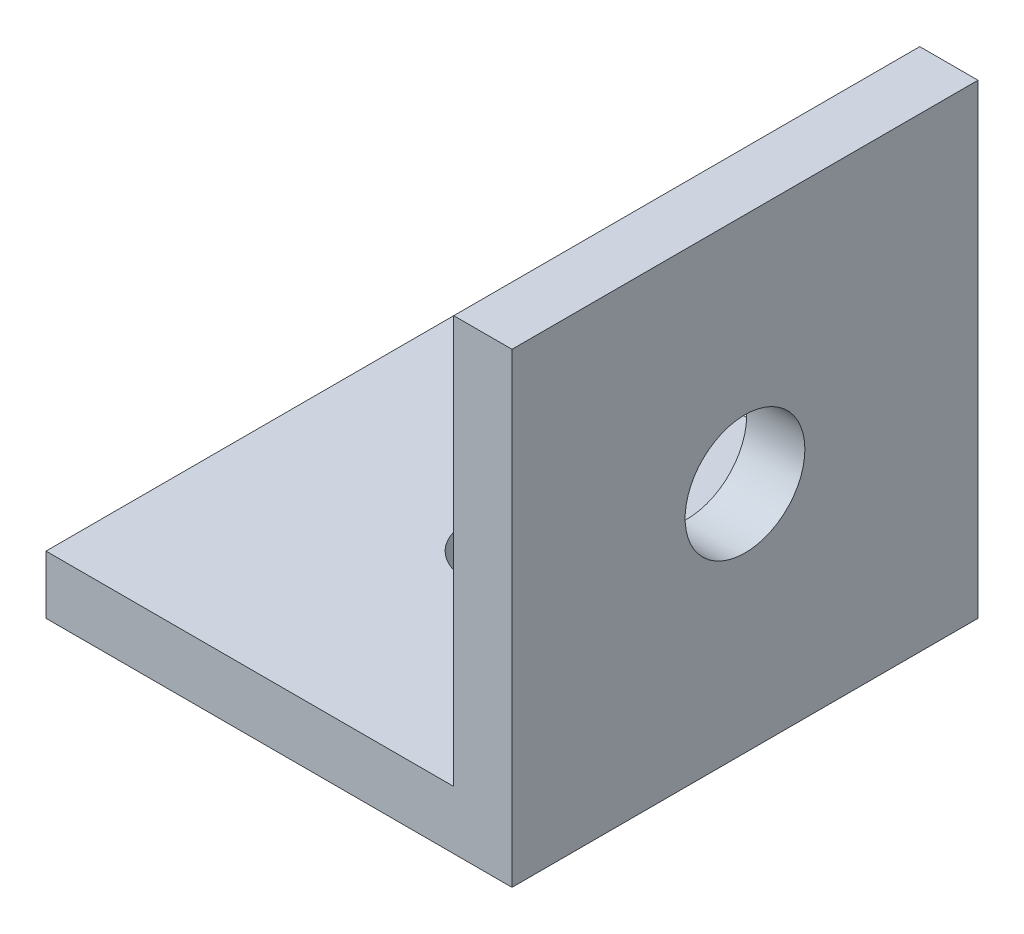
from build123d import *

# Parameters (mm, degrees)
BOSS_EXTRUDE1_DEPTH              = 25.4
F_13_64_0_20313_DIAMETER_HOLE1_D = 5.159375
F_0_257_DIAMETER_HOLE1_D         = 6.5278


with BuildPart() as part:
    # Sketch1 → Boss-Extrude1 (new body)
    with BuildSketch(Plane.XY):
        Polygon((0, 3.175), (22.225, 3.175), (22.225, 25.4), (25.4, 25.4), (25.4, 0), (0, 0), align=None)
    extrude(amount=BOSS_EXTRUDE1_DEPTH)

    # 13/64 (0.20313) Diameter Hole1 (through all)
    with Locations(Plane(origin=(0, 0, 0), x_dir=(-1, 0, 0), z_dir=(0, -1, 0))):
        with Locations((-12.7, -12.7)):
            Hole(F_13_64_0_20313_DIAMETER_HOLE1_D / 2)

    # F (0.257) Diameter Hole1 (through all)
    with Locations(Plane(origin=(25.4, 0, 0), x_dir=(0, 0, -1), z_dir=(1, 0, 0))):
        with Locations((-12.7, 12.7)):
            Hole(F_0_257_DIAMETER_HOLE1_D / 2)


solid = part.part
